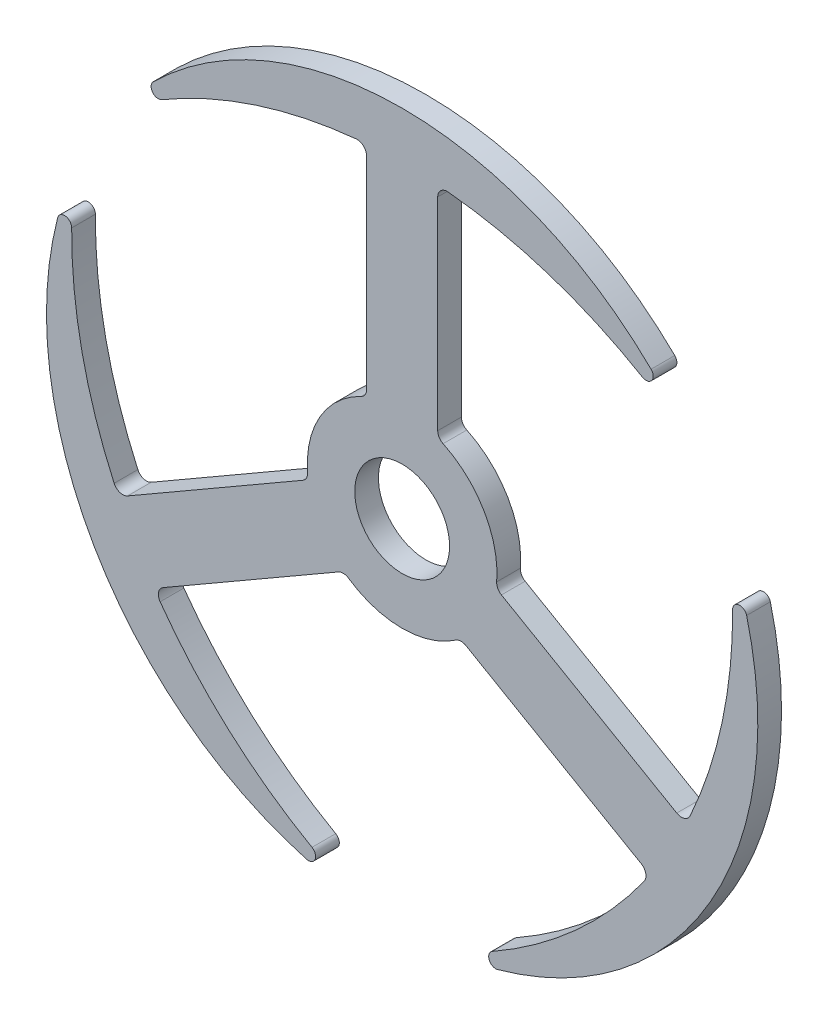
from build123d import *

# Parameters (mm, degrees)
SKETCH_1_R      = 1
EXTRUDE_2_DEPTH = 0.5


with BuildPart() as part:
    # Эскиз1 → Бобышка-Вытянуть2 (new body)
    with BuildSketch(Plane.XY):
        with BuildLine():
            Line((-0.75, 6.253845396), (-0.75, 1.984313483))
            ThreePointArc((-0.75, 1.984313483), (-0.780777178, 1.877713125), (-0.863636364, 1.803921348))
            ThreePointArc((-0.863636364, 1.803921348), (-1.732050808, 1), (-1.994059896, -0.154029644))
            ThreePointArc((-1.994059896, -0.154029644), (-2.016535856, -0.262683692), (-2.093465886, -0.342637689))
            Line((-2.093465886, -0.342637689), (-5.790988984, -2.477403645))
            ThreePointArc((-5.790988984, -2.477403645), (-5.952066421, -2.494644217), (-6.073072206, -2.38693731))
            ThreePointArc((-6.073072206, -2.38693731), (-6.750627118, -0.327987365), (-6.968602233, 1.828593814))
            ThreePointArc((-6.968602233, 1.828593814), (-7.099193079, 1.978512308), (-7.263875102, 1.867115022))
            ThreePointArc((-7.263875102, 1.867115022), (-6.495190528, -3.75), (-2.01496851, -7.224257879))
            ThreePointArc((-2.01496851, -7.224257879), (-1.836154619, -7.137337707), (-1.90069242, -6.949283469))
            ThreePointArc((-1.90069242, -6.949283469), (-3.659358949, -5.682220893), (-5.103684451, -4.065966154))
            ThreePointArc((-5.103684451, -4.065966154), (-5.136458476, -3.907318617), (-5.040988984, -3.776441751))
            Line((-5.040988984, -3.776441751), (-1.343465886, -1.641675794))
            ThreePointArc((-1.343465886, -1.641675794), (-1.235758679, -1.615029433), (-1.130423532, -1.649891705))
            ThreePointArc((-1.130423532, -1.649891705), (0, -2), (1.130423532, -1.649891705))
            ThreePointArc((1.130423532, -1.649891705), (1.235758679, -1.615029433), (1.343465886, -1.641675794))
            Line((1.343465886, -1.641675794), (5.040988984, -3.776441751))
            ThreePointArc((5.040988984, -3.776441751), (5.136458476, -3.907318617), (5.103684451, -4.065966154))
            ThreePointArc((5.103684451, -4.065966154), (3.659358949, -5.682220893), (1.90069242, -6.949283469))
            ThreePointArc((1.90069242, -6.949283469), (1.836154619, -7.137337707), (2.01496851, -7.224257879))
            ThreePointArc((2.01496851, -7.224257879), (6.495190528, -3.75), (7.263875102, 1.867115022))
            ThreePointArc((7.263875102, 1.867115022), (7.099193079, 1.978512308), (6.968602233, 1.828593814))
            ThreePointArc((6.968602233, 1.828593814), (6.750627118, -0.327987365), (6.073072206, -2.38693731))
            ThreePointArc((6.073072206, -2.38693731), (5.952066421, -2.494644217), (5.790988984, -2.477403645))
            Line((5.790988984, -2.477403645), (2.093465886, -0.342637689))
            ThreePointArc((2.093465886, -0.342637689), (2.016535856, -0.262683692), (1.994059896, -0.154029644))
            ThreePointArc((1.994059896, -0.154029644), (1.732050808, 1), (0.863636364, 1.803921348))
            ThreePointArc((0.863636364, 1.803921348), (0.780777178, 1.877713125), (0.75, 1.984313483))
            Line((0.75, 1.984313483), (0.75, 6.253845396))
            ThreePointArc((0.75, 6.253845396), (0.815607945, 6.401962834), (0.969387755, 6.452903465))
            ThreePointArc((0.969387755, 6.452903465), (3.091268168, 6.010208258), (5.067909813, 5.120689655))
            ThreePointArc((5.067909813, 5.120689655), (5.26303846, 5.158825399), (5.248906592, 5.357142857))
            ThreePointArc((5.248906592, 5.357142857), (0, 7.5), (-5.248906592, 5.357142857))
            ThreePointArc((-5.248906592, 5.357142857), (-5.26303846, 5.158825399), (-5.067909813, 5.120689655))
            ThreePointArc((-5.067909813, 5.120689655), (-3.091268168, 6.010208258), (-0.969387755, 6.452903465))
            ThreePointArc((-0.969387755, 6.452903465), (-0.815607945, 6.401962834), (-0.75, 6.253845396))
        make_face()
        Circle(SKETCH_1_R, mode=Mode.SUBTRACT)
    extrude(amount=EXTRUDE_2_DEPTH)


solid = part.part
